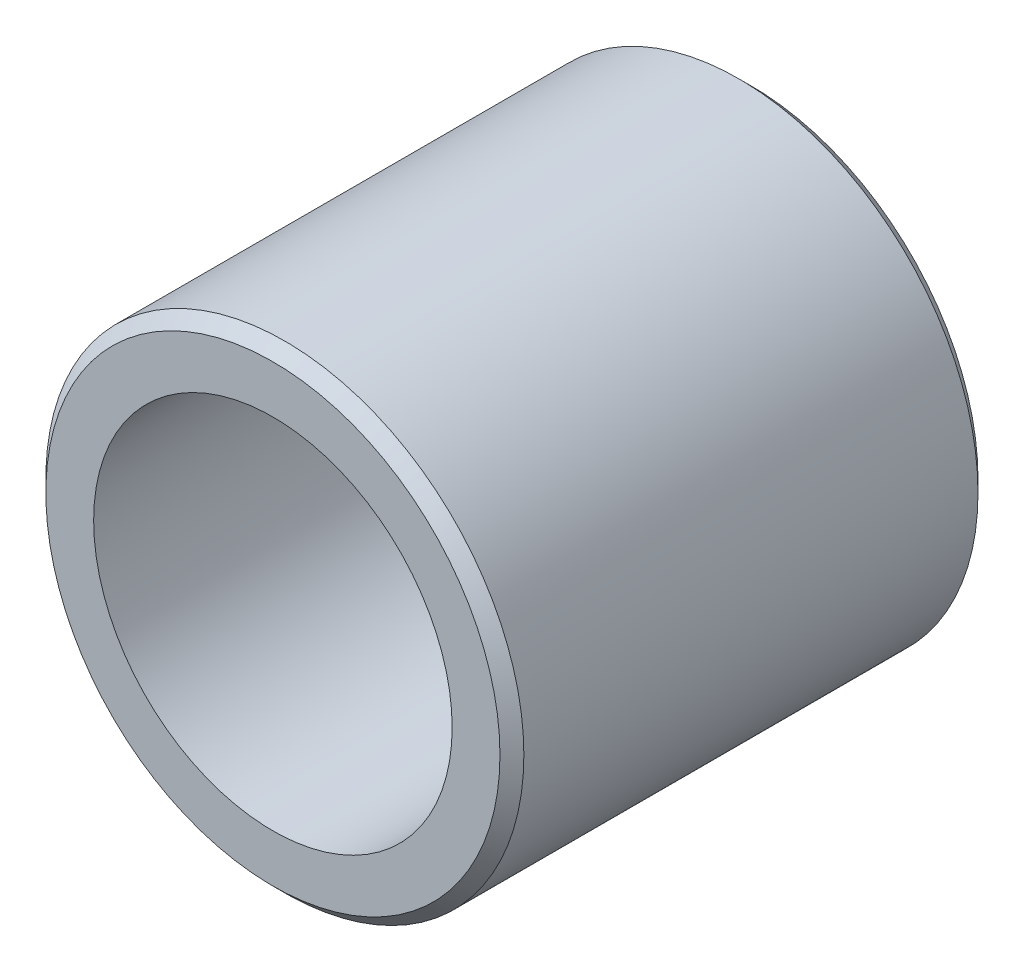
from build123d import *

# Parameters (mm, degrees)
SKETCH1_R           = 25.4
SKETCH1_R_2         = 19.05
BOSS_EXTRUDE1_DEPTH = 50.8
CHAMFER1_SIZE       = 1.27
CHAMFER2_SIZE       = 1.27


with BuildPart() as part:
    # Sketch1 → Boss-Extrude1 (new body)
    with BuildSketch(Plane.XY):
        Circle(SKETCH1_R)
        Circle(SKETCH1_R_2, mode=Mode.SUBTRACT)
    extrude(amount=BOSS_EXTRUDE1_DEPTH)

    # Chamfer1
    chamfer1_edges = [part.edges().sort_by_distance(p)[0] for p in [
        (-25.4, 0, 0),
    ]]
    chamfer(chamfer1_edges, length=CHAMFER1_SIZE)

    # Chamfer2
    chamfer2_edges = [part.edges().sort_by_distance(p)[0] for p in [
        (-25.4, 0, 50.8),
    ]]
    chamfer(chamfer2_edges, length=CHAMFER2_SIZE)


solid = part.part
